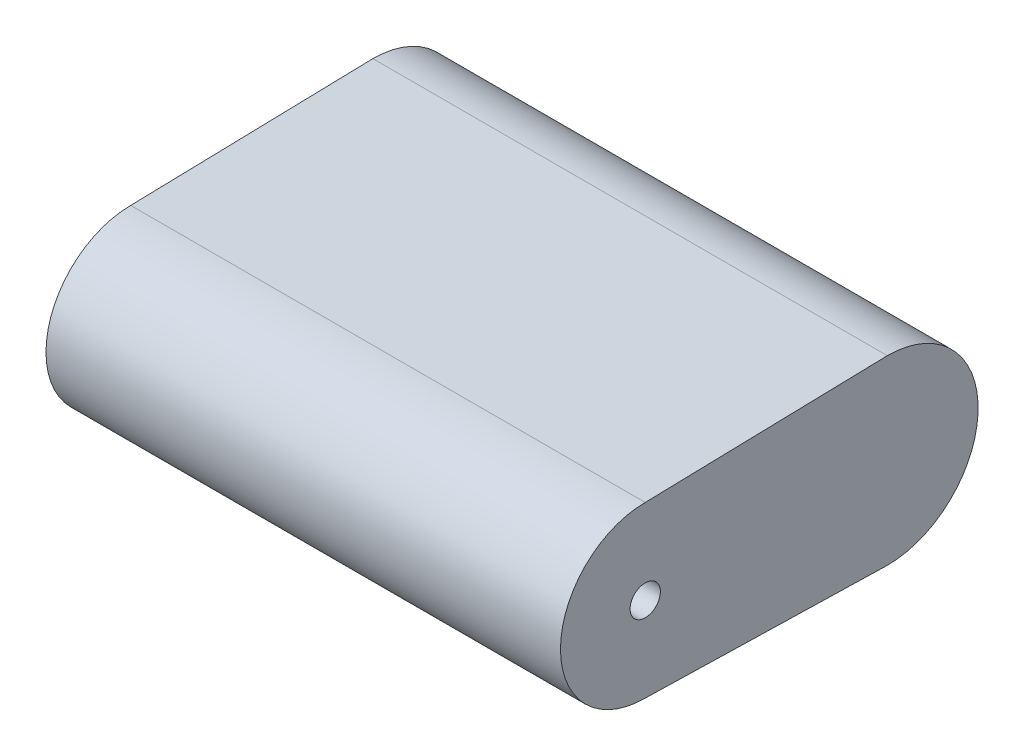
from build123d import *

# Parameters (mm, degrees)
CROQUIS1_R              = 2.5
SALIENTE_EXTRUIR1_DEPTH = 42.5


with BuildPart() as part:
    # Croquis1 → Saliente-Extruir1 (new, symmetric)
    with BuildSketch(Plane(origin=(0, 0, 0), x_dir=(0, 0, -1), z_dir=(1, 0, 0))):
        with BuildLine():
            Line((0, 14), (40, 15))
            ThreePointArc((40, 15), (55, 0), (40, -15))
            Line((40, -15), (0, -14))
            ThreePointArc((0, -14), (-14, 0), (0, 14))
        make_face()
        Circle(CROQUIS1_R, mode=Mode.SUBTRACT)
    extrude(amount=SALIENTE_EXTRUIR1_DEPTH, both=True)


solid = part.part
